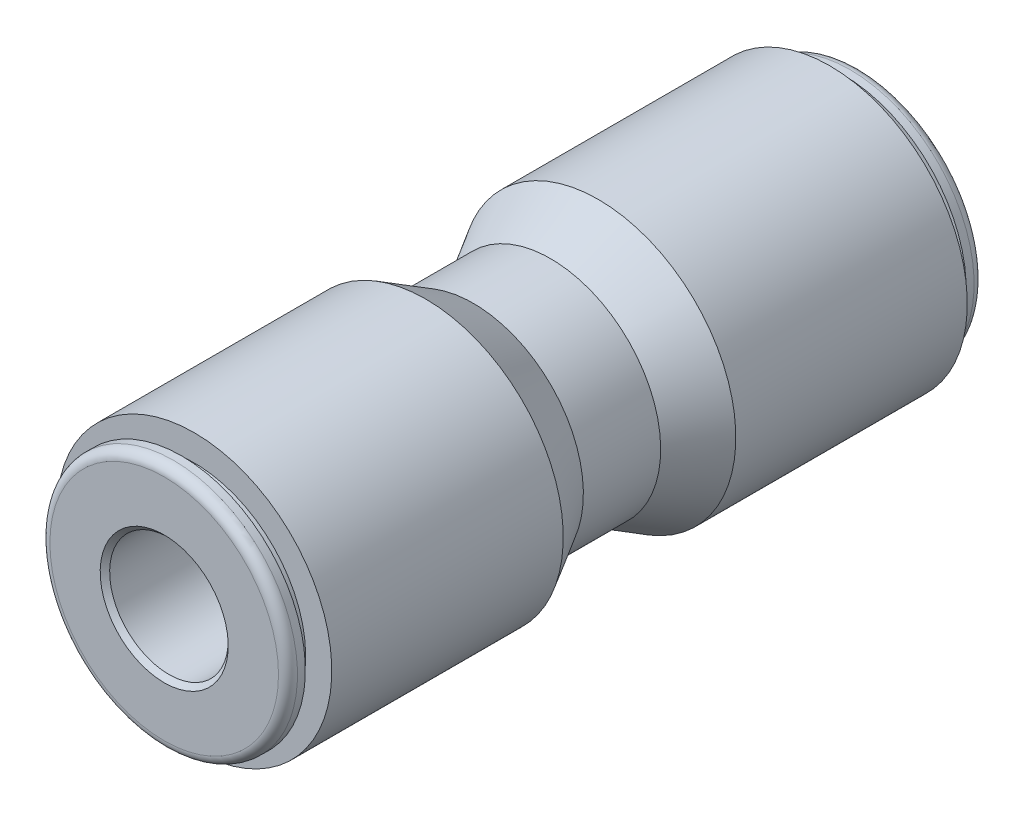
from build123d import *


with BuildPart() as part:
    # Sketch1 → Revolve1 (revolve)
    with BuildSketch(Plane(origin=(0, 0, 0), x_dir=(0, 0, -1), z_dir=(1, 0, 0)), mode=Mode.PRIVATE) as revolve1_sk:
        with BuildLine():
            Line((26.543, 9.9441), (27.178, 9.9441))
            ThreePointArc((27.178, 9.9441), (27.716815367, 9.720915367), (27.94, 9.1821))
            Line((27.94, 9.1821), (27.94, 6.731))
            Line((27.94, 6.731), (27.559, 6.35))
            Line((27.559, 6.35), (0.254, 6.35))
            Line((0.254, 6.35), (0.254, 3.175))
            Line((0.254, 3.175), (-7.112, 3.175))
            Line((-7.112, 3.175), (-7.112, 4.7625))
            Line((-7.112, 4.7625), (-27.559, 4.7625))
            Line((-27.559, 4.7625), (-27.94, 5.1435))
            Line((-27.94, 5.1435), (-27.94, 9.1821))
            ThreePointArc((-27.94, 9.1821), (-27.716815367, 9.720915367), (-27.178, 9.9441))
            Line((-27.178, 9.9441), (-26.543, 9.9441))
            Line((-26.543, 9.9441), (-26.543, 8.94969))
            Line((-26.543, 8.94969), (-25.527, 8.94969))
            Line((-25.527, 8.94969), (-25.527, 11.049))
            Line((-25.527, 11.049), (-6.931930319, 11.049))
            Line((-6.931930319, 11.049), (-3.104444444, 8.8392))
            Line((-3.104444444, 8.8392), (3.104444444, 8.8392))
            Line((3.104444444, 8.8392), (6.931930319, 11.049))
            Line((6.931930319, 11.049), (25.527, 11.049))
            Line((25.527, 11.049), (25.527, 8.94969))
            Line((25.527, 8.94969), (26.543, 8.94969))
            Line((26.543, 8.94969), (26.543, 9.9441))
        make_face()
    revolve(revolve1_sk.sketch.rotate(Axis((0, 0, 0), (0, 0, -1)), 180), axis=Axis((0, 0, 0), (0, 0, -1)))


solid = part.part
